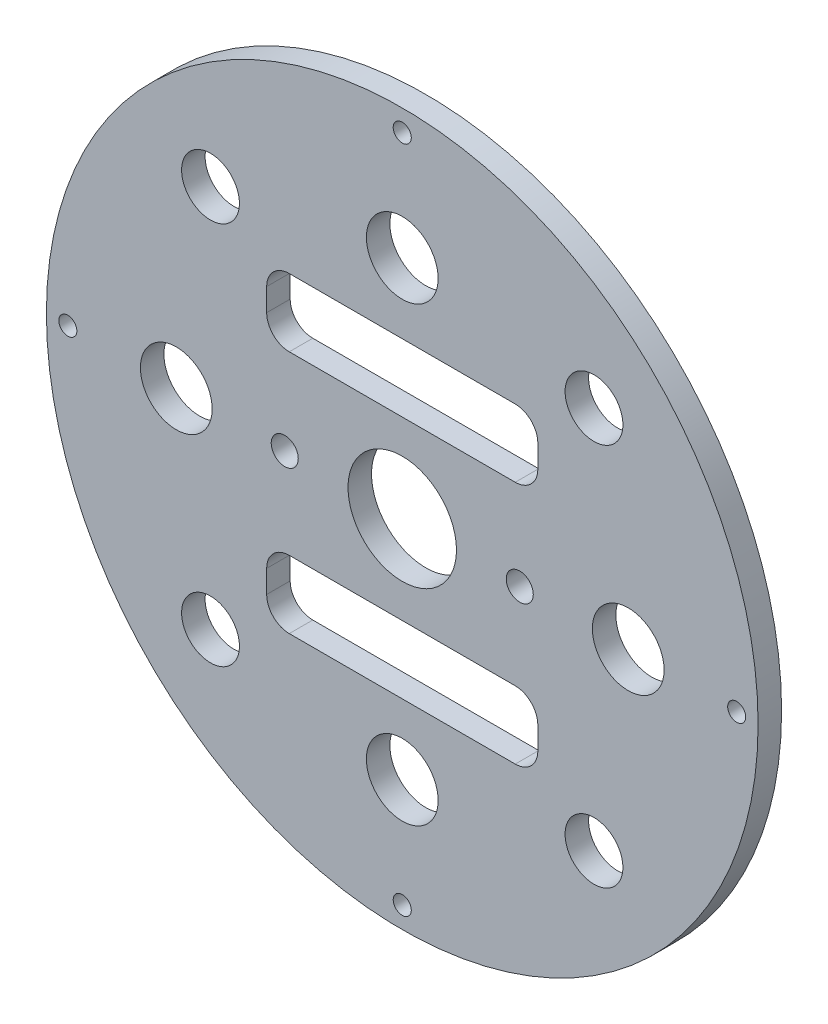
from build123d import *

# Parameters (mm, degrees)
SKETCH_1_R              = 50
EXTRUDE_1_DEPTH         = 3.302
SKETCH_2_R              = 4.064
CUT_EXTRUDE_1_DEPTH     = 71.787733429
SKETCH_4_R              = 7.62
CUT_EXTRUDE_3_DEPTH     = 71.787733429
SKETCH_7_R              = 1.27
CUT_EXTRUDE_6_DEPTH     = 71.787733429
F_3_8_CLEARANCE_HOLE1_D = 10.0838
SKETCH11_R              = 1.9
CUT_EXTRUDE5_DEPTH      = 71.787733429
CIRPATTERN1_COUNT       = 2
SKETCH12_W              = 38.1
SKETCH12_H              = 9.525
CUT_EXTRUDE6_DEPTH      = 71.787733429
FILLET1_R               = 3.175
FILLET1_OF_MIRROR1_R    = 3.175


with BuildPart() as part:
    # 草图1 → 凸台-拉伸1 (new body)
    with BuildSketch(Plane.XY):
        with Locations(Location((0, 0, 0), (0, 0, 180))):
            Circle(SKETCH_1_R)
    extrude(amount=EXTRUDE_1_DEPTH)

    # 草图2 → 切除-拉伸1 (cut, through all)
    with BuildSketch(Plane.XY.offset(3.302)):
        with Locations((-26.940768363, 26.940768363)):
            Circle(SKETCH_2_R)
        with Locations((-26.940768363, -26.940768363)):
            Circle(SKETCH_2_R)
        with Locations((26.940768363, -26.940768363)):
            Circle(SKETCH_2_R)
        with Locations((26.940768363, 26.940768363)):
            Circle(SKETCH_2_R)
    extrude(amount=-CUT_EXTRUDE_1_DEPTH, mode=Mode.SUBTRACT)

    # 草图4 → 切除-拉伸3 (cut, through all)
    with BuildSketch(Plane.XY.offset(3.302)):
        Circle(SKETCH_4_R)
    extrude(amount=-CUT_EXTRUDE_3_DEPTH, mode=Mode.SUBTRACT)

    # 草图7 → 切除-拉伸6 (cut, through all)
    with BuildSketch(Plane.XY.offset(3.302)):
        with Locations((0, 46.99)):
            Circle(SKETCH_7_R)
        with Locations((46.99, 0)):
            Circle(SKETCH_7_R)
        with Locations((0, -46.99)):
            Circle(SKETCH_7_R)
        with Locations((-46.99, 0)):
            Circle(SKETCH_7_R)
    extrude(amount=-CUT_EXTRUDE_6_DEPTH, mode=Mode.SUBTRACT)

    # 3/8 Clearance Hole1 (through all)
    with Locations(Plane.XY.offset(3.302)):
        with Locations((0, 31.75), (-31.75, 0), (31.75, 0), (0, -31.75)):
            Hole(F_3_8_CLEARANCE_HOLE1_D / 2)

    # Sketch11 → Cut-Extrude5 (cut, through all)
    with BuildSketch(Plane.XY.offset(3.302)):
        with Locations((-16.51, 0)):
            Circle(SKETCH11_R)
    cut_extrude5 = extrude(amount=-CUT_EXTRUDE5_DEPTH, mode=Mode.SUBTRACT)

    # CirPattern1: Cut-Extrude5 ×2 about axis
    cirpattern1_axis = Axis((0, 0, 0), (0, 0, 1))
    for i in range(1, CIRPATTERN1_COUNT):
        add(cut_extrude5.rotate(cirpattern1_axis, i * 360 / CIRPATTERN1_COUNT), mode=Mode.SUBTRACT)

    # Sketch12 → Cut-Extrude6 (cut, through all)
    with BuildSketch(Plane.XY.offset(3.302)):
        with Locations((0, 17.145)):
            Rectangle(SKETCH12_W, SKETCH12_H)
    cut_extrude6 = extrude(amount=-CUT_EXTRUDE6_DEPTH, mode=Mode.SUBTRACT)

    # Fillet1
    fillet1_edges = [part.edges().sort_by_distance(p)[0] for p in [
        (19.05, 21.9075, 1.651),
        (19.05, 12.3825, 1.651),
        (-19.05, 12.3825, 1.651),
        (-19.05, 21.9075, 1.651),
    ]]
    fillet(fillet1_edges, radius=FILLET1_R)

    # Mirror1: Cut-Extrude6 across plane
    add(cut_extrude6.mirror(Plane.ZX), mode=Mode.SUBTRACT)

    # Fillet1 of Mirror1
    fillet1_of_mirror1_edges = [part.edges().sort_by_distance(p)[0] for p in [
        (19.05, -21.9075, 1.651),
        (19.05, -12.3825, 1.651),
        (-19.05, -12.3825, 1.651),
        (-19.05, -21.9075, 1.651),
    ]]
    fillet(fillet1_of_mirror1_edges, radius=FILLET1_OF_MIRROR1_R)


solid = part.part
